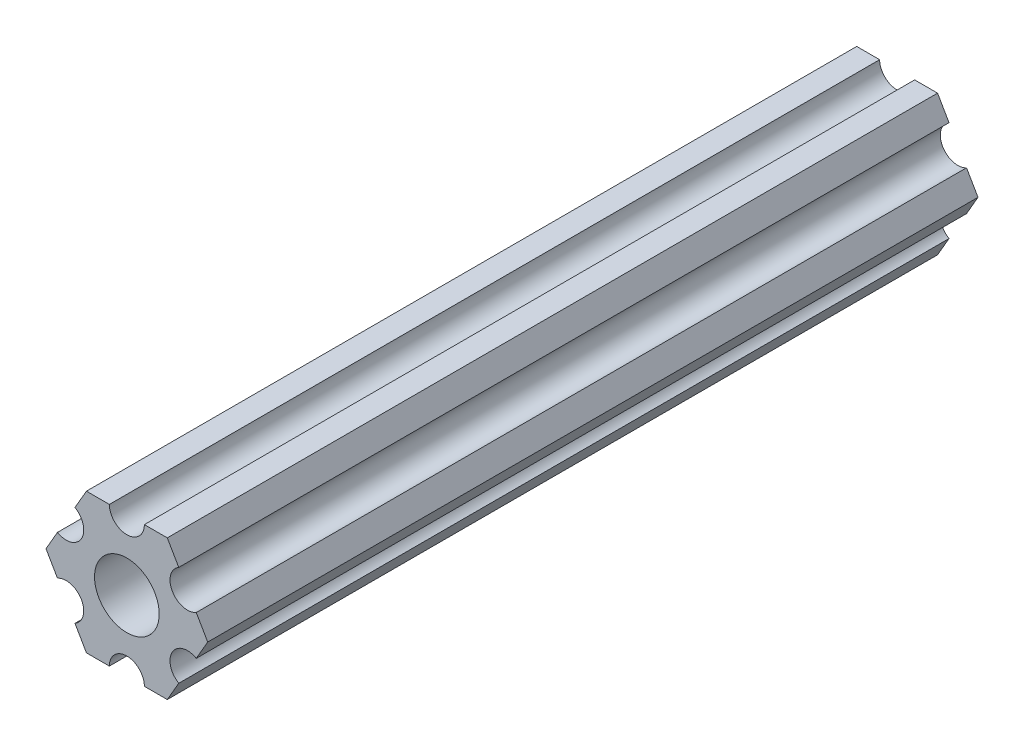
from build123d import *

# Parameters (mm, degrees)
SKETCH1_R           = 2.9337
BOSS_EXTRUDE1_DEPTH = 69.85


with BuildPart() as part:
    # Sketch1 → Boss-Extrude1 (new body)
    with BuildSketch(Plane(origin=(0, 0, 0), x_dir=(-1, 0, 0), z_dir=(0, 0, -1))):
        with BuildLine():
            Line((-4.70551159, -4.549815043), (-3.666174521, -6.349999904))
            Line((-3.666174521, -6.349999904), (-1.587500385, -6.349999904))
            ThreePointArc((-1.587500385, -6.349999904), (-3.85e-07, -4.762499904), (1.587499615, -6.349999904))
            Line((1.587499615, -6.349999904), (3.666173825, -6.349999904))
            Line((3.666173825, -6.349999904), (4.705510942, -4.54981524))
            ThreePointArc((4.705510942, -4.54981524), (4.124445629, -2.381249907), (6.293010962, -1.800184594))
            Line((6.293010962, -1.800184594), (7.332348079, 7e-08))
            Line((7.332348079, 7e-08), (6.293011217, 1.800184685))
            ThreePointArc((6.293011217, 1.800184685), (4.124445939, 2.381250203), (4.705511457, 4.549815481))
            Line((4.705511457, 4.549815481), (3.666174521, 6.350000222))
            Line((3.666174521, 6.350000222), (1.587500385, 6.350000222))
            ThreePointArc((1.587500385, 6.350000222), (3.85e-07, 4.762500222), (-1.587499615, 6.350000222))
            Line((-1.587499615, 6.350000222), (-3.666173825, 6.350000222))
            Line((-3.666173825, 6.350000222), (-4.705511038, 4.549815614))
            ThreePointArc((-4.705511038, 4.549815614), (-4.124445841, 2.38125025), (-6.293011205, 1.800185053))
            Line((-6.293011205, 1.800185053), (-7.332348419, 4.44e-07))
            Line((-7.332348419, 4.44e-07), (-6.293011423, -1.80018429))
            ThreePointArc((-6.293011423, -1.80018429), (-4.12444613, -2.38124975), (-4.70551159, -4.549815043))
        make_face()
        with Locations(Location((0, 0, 0), (0, 0, 180))):
            Circle(SKETCH1_R, mode=Mode.SUBTRACT)
    extrude(amount=BOSS_EXTRUDE1_DEPTH)


solid = part.part
